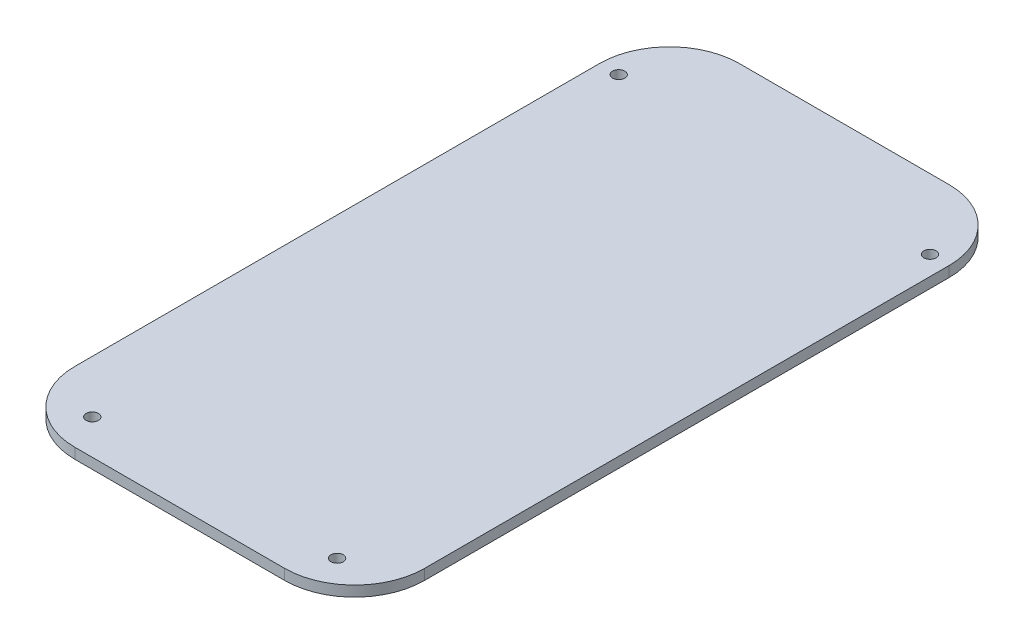
from build123d import *

# Parameters (mm, degrees)
SKETCH1_R           = 1.75
BOSS_EXTRUDE1_DEPTH = 3


with BuildPart() as part:
    # Sketch1 → Boss-Extrude1 (new body)
    with BuildSketch(Plane(origin=(0, 0, 0), x_dir=(1, 0, 0), z_dir=(0, 1, 0))):
        with BuildLine():
            Line((20, 0), (80, 0))
            ThreePointArc((80, 0), (94.142135624, 5.857864376), (100, 20))
            Line((100, 20), (100, 170))
            ThreePointArc((100, 170), (94.142135624, 184.142135624), (80, 190))
            Line((80, 190), (20, 190))
            ThreePointArc((20, 190), (5.857864376, 184.142135624), (0, 170))
            Line((0, 170), (0, 20))
            ThreePointArc((0, 20), (5.857864376, 5.857864376), (20, 0))
        make_face()
        with Locations(Location((5.5, 170, 0), (0, 0, 270))):
            Circle(SKETCH1_R, mode=Mode.SUBTRACT)
        with Locations(Location((15, 10, 0), (0, 0, 270))):
            Circle(SKETCH1_R, mode=Mode.SUBTRACT)
        with Locations(Location((85, 10, 0), (0, 0, 90))):
            Circle(SKETCH1_R, mode=Mode.SUBTRACT)
        with Locations(Location((94.5, 170, 0), (0, 0, 90))):
            Circle(SKETCH1_R, mode=Mode.SUBTRACT)
    extrude(amount=BOSS_EXTRUDE1_DEPTH)


solid = part.part
